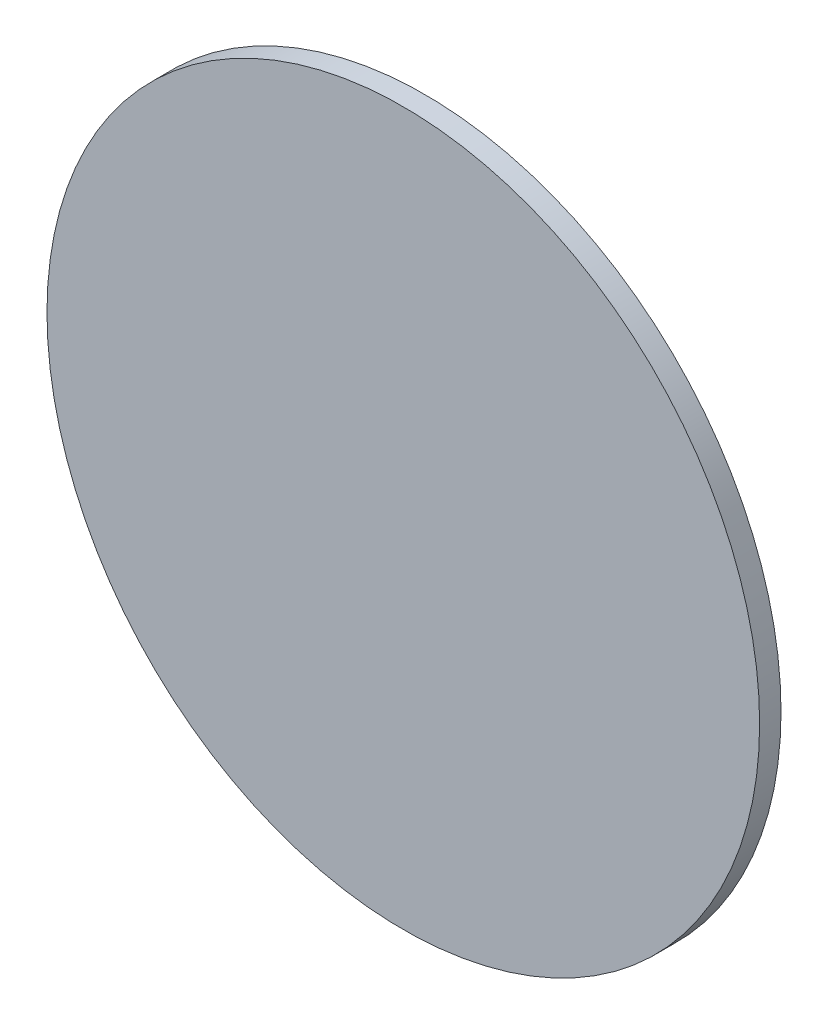
from build123d import *

# Parameters (mm, degrees)
SKETCH1_R           = 50
BOSS_EXTRUDE1_DEPTH = 3


with BuildPart() as part:
    # Sketch1 → Boss-Extrude1 (new body)
    with BuildSketch(Plane.XY):
        Circle(SKETCH1_R)
    extrude(amount=BOSS_EXTRUDE1_DEPTH)


solid = part.part
